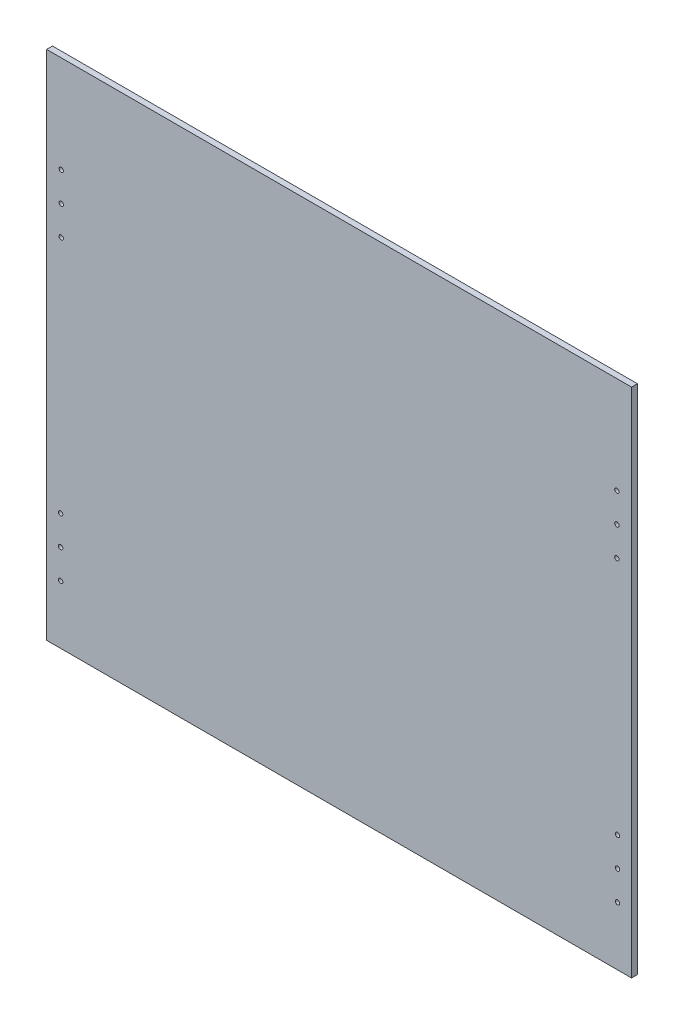
from build123d import *

# Parameters (mm, degrees)
SKETCH1_W           = 400
SKETCH1_H           = 350
SKETCH1_R           = 1.5
BOSS_EXTRUDE1_DEPTH = 4


with BuildPart() as part:
    # Sketch1 → Boss-Extrude1 (new body)
    with BuildSketch(Plane.XY):
        Rectangle(SKETCH1_W, SKETCH1_H)
        with Locations((190.420210886, -135)):
            Circle(SKETCH1_R, mode=Mode.SUBTRACT)
        with Locations((190.420210886, -115)):
            Circle(SKETCH1_R, mode=Mode.SUBTRACT)
        with Locations((190.420210886, -95)):
            Circle(SKETCH1_R, mode=Mode.SUBTRACT)
        with Locations((190, 68.62)):
            Circle(SKETCH1_R, mode=Mode.SUBTRACT)
        with Locations((190, 88.62)):
            Circle(SKETCH1_R, mode=Mode.SUBTRACT)
        with Locations((190, 108.62)):
            Circle(SKETCH1_R, mode=Mode.SUBTRACT)
        with Locations(Location((-190.420210886, -135, 0), (0, 0, 180))):
            Circle(SKETCH1_R, mode=Mode.SUBTRACT)
        with Locations(Location((-190.420210886, -95, 0), (0, 0, 180))):
            Circle(SKETCH1_R, mode=Mode.SUBTRACT)
        with Locations(Location((-190.420210886, -115, 0), (0, 0, 180))):
            Circle(SKETCH1_R, mode=Mode.SUBTRACT)
        with Locations(Location((-190, 68.62, 0), (0, 0, 180))):
            Circle(SKETCH1_R, mode=Mode.SUBTRACT)
        with Locations(Location((-190, 88.62, 0), (0, 0, 180))):
            Circle(SKETCH1_R, mode=Mode.SUBTRACT)
        with Locations(Location((-190, 108.62, 0), (0, 0, 180))):
            Circle(SKETCH1_R, mode=Mode.SUBTRACT)
    extrude(amount=BOSS_EXTRUDE1_DEPTH)


solid = part.part
